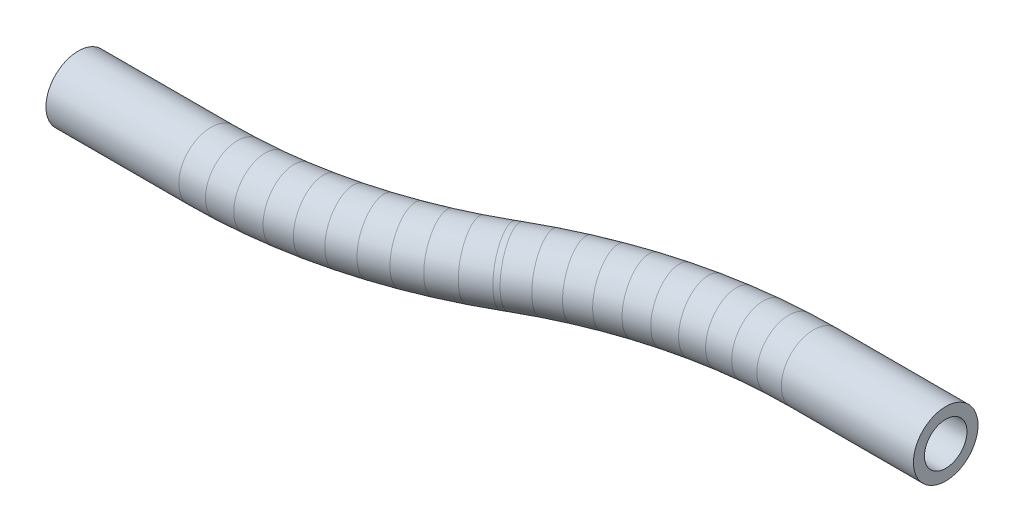
from build123d import *

# Parameters (mm, degrees)
PROFILE_R   = 6
PROFILE_R_2 = 3.95


with BuildPart() as part:
    # Tube: sweep along a curve in space
    with BuildLine() as tube_path:
        Line((-140, 103.05702305, 59.5), (-115.387400297, 103.05702305, 59.5))
        Line((-115.387400297, 103.05702305, 59.5), (-110.735387898, 103.067925477, 59.394421789))
        Line((-110.735387898, 103.067925477, 59.394421789), (-106.093057124, 103.100610068, 59.077906882))
        Line((-106.093057124, 103.100610068, 59.077906882), (-101.470069452, 103.155008801, 58.551114001))
        Line((-101.470069452, 103.155008801, 58.551114001), (-96.876046101, 103.231008462, 57.81513949))
        Line((-96.876046101, 103.231008462, 57.81513949), (-92.320548011, 103.328450885, 56.871515038))
        Line((-92.320548011, 103.328450885, 56.871515038), (-87.813055945, 103.447133273, 55.722204485))
        Line((-87.813055945, 103.447133273, 55.722204485), (-83.362950757, 103.586808631, 54.369599743))
        Line((-83.362950757, 103.586808631, 54.369599743), (-78.979493869, 103.747186268, 52.81651581))
        Line((-78.979493869, 103.747186268, 52.81651581), (-74.671807996, 103.927932413, 51.066184917))
        Line((-74.671807996, 103.927932413, 51.066184917), (-70.448858163, 104.128670902, 49.122249798))
        Line((-70.448858163, 104.128670902, 49.122249798), (-69.551141837, 104.173925677, 48.684006254))
        Line((-69.551141837, 104.173925677, 48.684006254), (-65.328192004, 104.374664166, 46.740071136))
        Line((-65.328192004, 104.374664166, 46.740071136), (-61.020506131, 104.55541031, 44.989740243))
        Line((-61.020506131, 104.55541031, 44.989740243), (-56.637049243, 104.715787948, 43.43665631))
        Line((-56.637049243, 104.715787948, 43.43665631), (-52.186944055, 104.855463305, 42.084051567))
        Line((-52.186944055, 104.855463305, 42.084051567), (-47.679451989, 104.974145694, 40.934741015))
        Line((-47.679451989, 104.974145694, 40.934741015), (-43.123953899, 105.071588116, 39.991116562))
        Line((-43.123953899, 105.071588116, 39.991116562), (-38.529930548, 105.147587778, 39.255142051))
        Line((-38.529930548, 105.147587778, 39.255142051), (-33.906942876, 105.20198651, 38.72834917))
        Line((-33.906942876, 105.20198651, 38.72834917), (-29.264612102, 105.234671101, 38.411834263))
        Line((-29.264612102, 105.234671101, 38.411834263), (-24.612599703, 105.245573528, 38.306256052))
        Line((-24.612599703, 105.245573528, 38.306256052), (0, 105.245573528, 38.306256052))
    # Profile → Tube (sweep)
    with BuildSketch(Plane(origin=(-140, 0, 0), x_dir=(0, 0, -1), z_dir=(1, 0, 0))):
        with Locations((-59.5, 103.05702305)):
            Circle(PROFILE_R)
        with Locations((-59.5, 103.05702305)):
            Circle(PROFILE_R_2, mode=Mode.SUBTRACT)
    sweep(path=tube_path.line, transition=Transition.RIGHT)


solid = part.part
